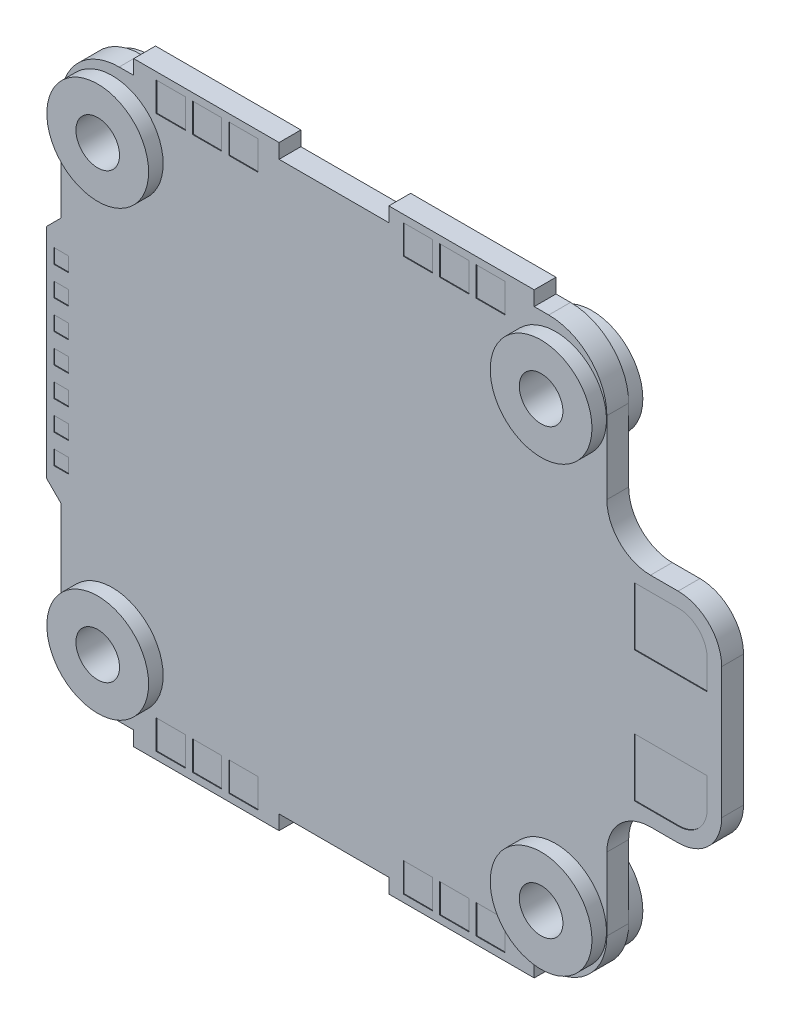
from build123d import *

# Parameters (mm, degrees)
CROQUIS1_R              = 2.5
SALIENTE_EXTRUIR1_DEPTH = 1.5
MATRIZL1_COUNT          = 2
MATRIZL1_PITCH          = 30.5
MATRIZL1_COUNT_DIR2     = 2
MATRIZL1_PITCH_DIR2     = 30.5
CROQUIS4_W              = 2
CROQUIS4_H              = 2
CROQUIS4_W_2            = 1
CROQUIS4_H_2            = 1
CORTAR_EXTRUIR1_DEPTH   = 0.05


with BuildPart() as part:
    # Croquis1 → Saliente-Extruir1 (new body)
    with BuildSketch(Plane.XY):
        with BuildLine():
            Line((-19.66677388, 13.695977011), (-19.66677388, 6.695977011))
            Line((-19.66677388, 6.695977011), (-20.66677388, 5.695977011))
            Line((-20.66677388, 5.695977011), (-20.66677388, -9.304022989))
            Line((-20.66677388, -9.304022989), (-19.66677388, -10.304022989))
            Line((-19.66677388, -10.304022989), (-19.66677388, -17.304022989))
            ThreePointArc((-19.66677388, -17.304022989), (-18.495201005, -20.132450113), (-15.66677388, -21.304022989))
            Line((-15.66677388, -21.304022989), (-14.66677388, -21.304022989))
            Line((-14.66677388, -21.304022989), (-14.66677388, -22.304022989))
            Line((-14.66677388, -22.304022989), (-4.66677388, -22.304022989))
            Line((-4.66677388, -22.304022989), (-4.66677388, -21.304022989))
            Line((-4.66677388, -21.304022989), (2.88322612, -21.304022989))
            Line((2.88322612, -21.304022989), (2.88322612, -22.304022989))
            Line((2.88322612, -22.304022989), (12.88322612, -22.304022989))
            Line((12.88322612, -22.304022989), (12.88322612, -21.304022989))
            Line((12.88322612, -21.304022989), (13.88322612, -21.304022989))
            ThreePointArc((13.88322612, -21.304022989), (16.711653245, -20.132450113), (17.88322612, -17.304022989))
            Line((17.88322612, -17.304022989), (17.88322612, -12.304022989))
            ThreePointArc((17.88322612, -12.304022989), (18.761905777, -10.182702645), (20.88322612, -9.304022989))
            Line((20.88322612, -9.304022989), (22.78322612, -9.304022989))
            ThreePointArc((22.78322612, -9.304022989), (24.904546464, -8.425343332), (25.78322612, -6.304022989))
            Line((25.78322612, -6.304022989), (25.78322612, 2.695977011))
            ThreePointArc((25.78322612, 2.695977011), (24.904546464, 4.817297355), (22.78322612, 5.695977011))
            Line((22.78322612, 5.695977011), (20.88322612, 5.695977011))
            ThreePointArc((20.88322612, 5.695977011), (18.761905777, 6.574656668), (17.88322612, 8.695977011))
            Line((17.88322612, 8.695977011), (17.88322612, 13.695977011))
            ThreePointArc((17.88322612, 13.695977011), (16.711653245, 16.524404136), (13.88322612, 17.695977011))
            Line((13.88322612, 17.695977011), (12.88322612, 17.695977011))
            Line((12.88322612, 17.695977011), (12.88322612, 18.695977011))
            Line((12.88322612, 18.695977011), (2.88322612, 18.695977011))
            Line((2.88322612, 18.695977011), (2.88322612, 17.695977011))
            Line((2.88322612, 17.695977011), (-4.66677388, 17.695977011))
            Line((-4.66677388, 17.695977011), (-4.66677388, 18.695977011))
            Line((-4.66677388, 18.695977011), (-14.66677388, 18.695977011))
            Line((-14.66677388, 18.695977011), (-14.66677388, 17.695977011))
            Line((-14.66677388, 17.695977011), (-15.66677388, 17.695977011))
            ThreePointArc((-15.66677388, 17.695977011), (-18.495201005, 16.524404136), (-19.66677388, 13.695977011))
        make_face()
        with Locations((-16.14177388, 13.445977011)):
            Circle(CROQUIS1_R, mode=Mode.SUBTRACT)
        with Locations((14.35822612, 13.445977011)):
            Circle(CROQUIS1_R, mode=Mode.SUBTRACT)
        with Locations((14.35822612, -17.054022989)):
            Circle(CROQUIS1_R, mode=Mode.SUBTRACT)
        with Locations((-16.14177388, -17.054022989)):
            Circle(CROQUIS1_R, mode=Mode.SUBTRACT)
    extrude(amount=SALIENTE_EXTRUIR1_DEPTH)

    # Croquis3 → Revolución1 (revolve)
    with BuildSketch(Plane(origin=(0, -17.054022989, 0), x_dir=(-1, 0, 0), z_dir=(0, -1, 0)), mode=Mode.PRIVATE) as revoluci_n1_sk:
        Polygon((18.64177388, -1.5), (19.64177388, -1.5), (19.64177388, -2.5), (17.64177388, -2.5), (17.64177388, 1), (19.64177388, 1), (19.64177388, 0), (18.64177388, 0), align=None)
    revoluci_n1 = revolve(revoluci_n1_sk.sketch.rotate(Axis((-16.14177388, -17.054022989, 2.5), (0, 0, -1)), 180), axis=Axis((-16.14177388, -17.054022989, 2.5), (0, 0, -1)))

    # MatrizL1: Revoluci_n1 2 × 2
    with Locations(*[(i * MATRIZL1_PITCH, j * MATRIZL1_PITCH_DIR2, 0) for i in range(MATRIZL1_COUNT) for j in range(MATRIZL1_COUNT_DIR2) if (i, j) != (0, 0)]):
        add(revoluci_n1)

    # Croquis4 → Cortar-Extruir1 (cut)
    with BuildSketch(Plane.XY.offset(1.5)):
        with BuildLine():
            Line((19.78322612, -8.304022989), (22.78322612, -8.304022989))
            ThreePointArc((22.78322612, -8.304022989), (24.197439683, -7.718236551), (24.78322612, -6.304022989))
            Line((24.78322612, -6.304022989), (24.78322612, -4.304022989))
            Line((24.78322612, -4.304022989), (19.78322612, -4.304022989))
            Line((19.78322612, -4.304022989), (19.78322612, -8.304022989))
        make_face()
        with Locations((9.88322612, -20.804022989)):
            Rectangle(CROQUIS4_W, CROQUIS4_H)
        with Locations((-19.66677388, -7.804022989)):
            Rectangle(CROQUIS4_W_2, CROQUIS4_H_2)
        with Locations((7.38322612, -20.804022989)):
            Rectangle(CROQUIS4_W, CROQUIS4_H)
        with Locations((4.88322612, -20.804022989)):
            Rectangle(CROQUIS4_W, CROQUIS4_H)
        with Locations((-7.11677388, -20.804022989)):
            Rectangle(CROQUIS4_W, CROQUIS4_H)
        with Locations((-9.61677388, -20.804022989)):
            Rectangle(CROQUIS4_W, CROQUIS4_H)
        with Locations((-12.11677388, -20.804022989)):
            Rectangle(CROQUIS4_W, CROQUIS4_H)
        with Locations((-19.66677388, -5.804022989)):
            Rectangle(CROQUIS4_W_2, CROQUIS4_H_2)
        with Locations((-19.66677388, -3.804022989)):
            Rectangle(CROQUIS4_W_2, CROQUIS4_H_2)
        with Locations((-19.66677388, -1.804022989)):
            Rectangle(CROQUIS4_W_2, CROQUIS4_H_2)
        with Locations((-19.66677388, 0.195977011)):
            Rectangle(CROQUIS4_W_2, CROQUIS4_H_2)
        with Locations((-19.66677388, 2.195977011)):
            Rectangle(CROQUIS4_W_2, CROQUIS4_H_2)
        with Locations((-19.66677388, 4.195977011)):
            Rectangle(CROQUIS4_W_2, CROQUIS4_H_2)
        with Locations((-12.11677388, 17.195977011)):
            Rectangle(CROQUIS4_W, CROQUIS4_H)
        with Locations((-9.61677388, 17.195977011)):
            Rectangle(CROQUIS4_W, CROQUIS4_H)
        with Locations((-7.11677388, 17.195977011)):
            Rectangle(CROQUIS4_W, CROQUIS4_H)
        with Locations((4.88322612, 17.195977011)):
            Rectangle(CROQUIS4_W, CROQUIS4_H)
        with Locations((7.38322612, 17.195977011)):
            Rectangle(CROQUIS4_W, CROQUIS4_H)
        with Locations((9.88322612, 17.195977011)):
            Rectangle(CROQUIS4_W, CROQUIS4_H)
        with BuildLine():
            Line((24.78322612, 2.695977011), (24.78322612, 0.695977011))
            Line((24.78322612, 0.695977011), (19.78322612, 0.695977011))
            Line((19.78322612, 0.695977011), (19.78322612, 4.695977011))
            Line((19.78322612, 4.695977011), (22.78322612, 4.695977011))
            ThreePointArc((22.78322612, 4.695977011), (24.197439683, 4.110190574), (24.78322612, 2.695977011))
        make_face()
    extrude(amount=-CORTAR_EXTRUIR1_DEPTH, mode=Mode.SUBTRACT)


solid = part.part
